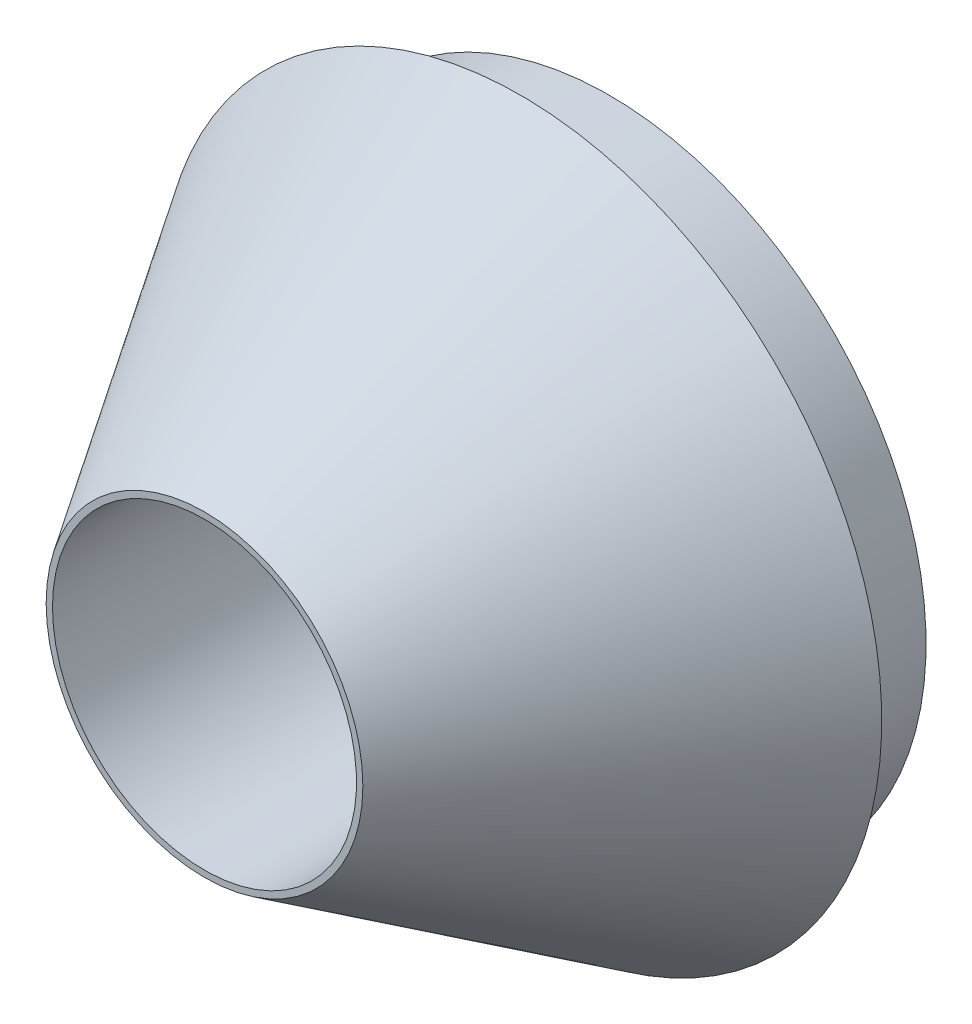
from build123d import *

# Parameters (mm, degrees)
SKETCH2_R          = 6.096
CUT_EXTRUDE1_DEPTH = 17.78


with BuildPart() as part:
    # Sketch1 → Revolve2 (revolve)
    with BuildSketch(Plane(origin=(0, 0, 0), x_dir=(1, 0, 0), z_dir=(0, 1, 0)), mode=Mode.PRIVATE) as revolve2_sk:
        Polygon((0, 0), (6.35, 0), (14.478, 12.678729064), (12.7, 12.678729064), (12.7, 16.234729064), (0, 16.234729064), align=None)
    revolve(revolve2_sk.sketch.rotate(Axis((0, 0, -16.234729064), (0, 0, 1)), 180), axis=Axis((0, 0, -16.234729064), (0, 0, 1)))

    # Sketch2 → Cut-Extrude1 (cut)
    with BuildSketch(Plane(origin=(0, 0, -16.234729064), x_dir=(-1, 0, 0), z_dir=(0, 0, -1))):
        Circle(SKETCH2_R)
    extrude(amount=-CUT_EXTRUDE1_DEPTH, mode=Mode.SUBTRACT)


solid = part.part
